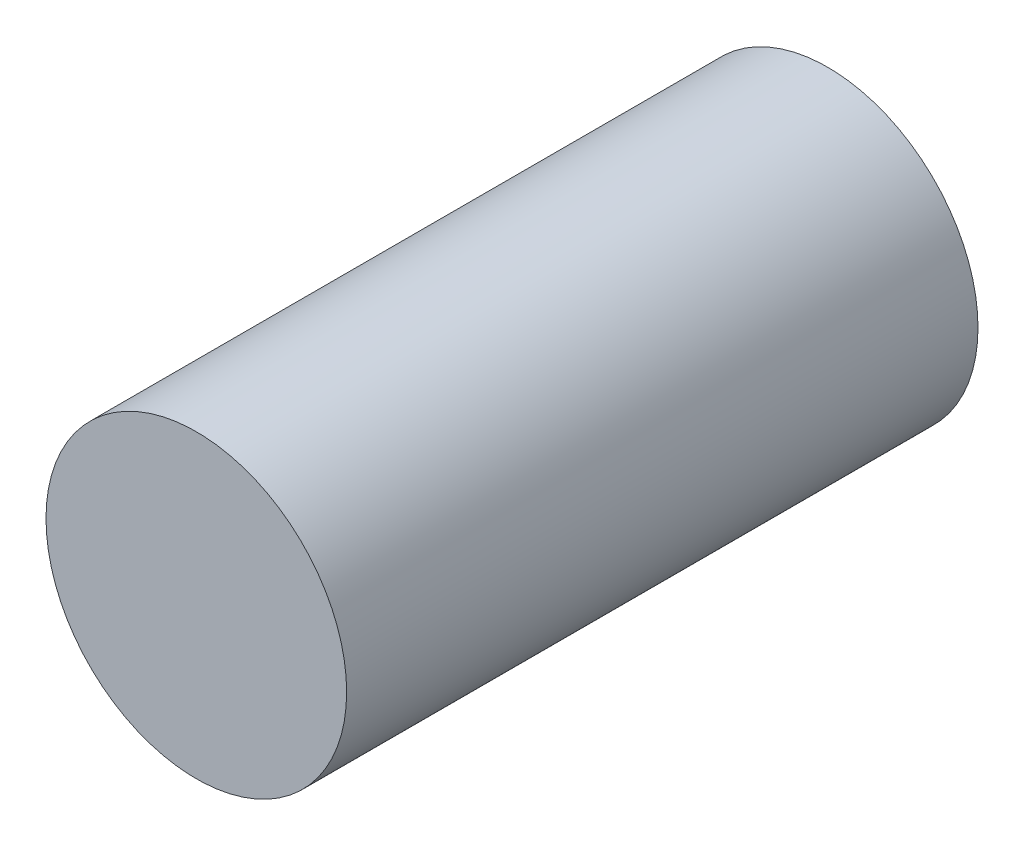
from build123d import *

# Parameters (mm, degrees)
CROQUIS1_R              = 7.5
SALIENTE_EXTRUIR1_DEPTH = 31.5


with BuildPart() as part:
    # Croquis1 → Saliente-Extruir1 (new body)
    with BuildSketch(Plane.XY):
        Circle(CROQUIS1_R)
    extrude(amount=SALIENTE_EXTRUIR1_DEPTH)


solid = part.part
